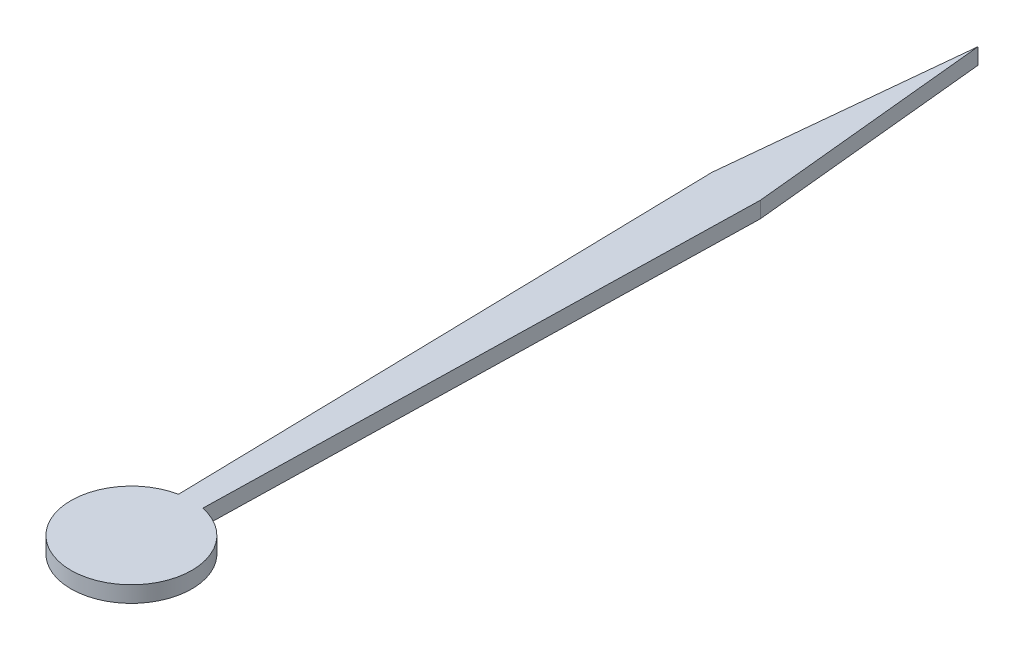
from build123d import *

# Parameters (mm, degrees)
EXTRUDE1_DEPTH = 0.2


with BuildPart() as part:
    # Sketch1 → Extrude1 (new body)
    with BuildSketch(Plane(origin=(0, 0, 0), x_dir=(1, 0, 0), z_dir=(0, 1, 0))):
        with BuildLine():
            Line((0, 10.5), (0.3, 7.5))
            Line((0.3, 7.5), (0.15, 0.734846923))
            ThreePointArc((0.15, 0.734846923), (0, -0.75), (-0.15, 0.734846923))
            Line((-0.15, 0.734846923), (-0.3, 7.5))
            Line((-0.3, 7.5), (0, 10.5))
        make_face()
    extrude(amount=EXTRUDE1_DEPTH)


solid = part.part
